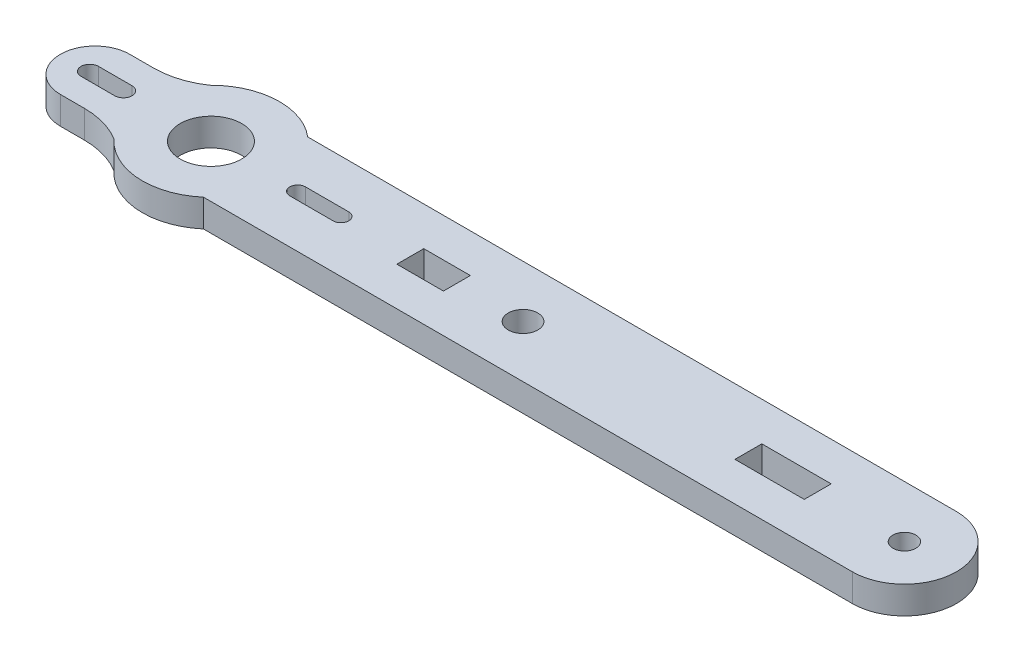
from build123d import *

# Parameters (mm, degrees)
SKETCH1_R           = 1.322622219
SKETCH1_R_2         = 1.7
SKETCH1_R_3         = 3.543581518
SKETCH1_W           = 5.363642664
SKETCH1_H           = 3.09972609
BOSS_EXTRUDE1_DEPTH = 3.175


with BuildPart() as part:
    # Sketch1 → Boss-Extrude1 (new body)
    with BuildSketch(Plane(origin=(0, 0, 0), x_dir=(1, 0, 0), z_dir=(0, 1, 0))):
        with BuildLine():
            Line((-30.420224954, 6.394505262), (44.302185909, 6.390032423))
            ThreePointArc((44.302185909, 6.390032423), (50.304735151, 0.387483181), (44.302185909, -5.61506606))
            Line((44.302185909, -5.61506606), (-30.420308604, -5.61506606))
            ThreePointArc((-30.420308604, -5.61506606), (-36.033562007, -7.500021548), (-41.380965097, -4.957001462))
            ThreePointArc((-41.380965097, -4.957001462), (-43.672708861, -3.953506377), (-46.150888165, -3.610404055))
            Line((-46.150888165, -3.610404055), (-48.909665253, -3.610404055))
            ThreePointArc((-48.909665253, -3.610404055), (-52.90984424, 0.389774933), (-48.909665253, 4.38995392))
            Line((-48.909665253, 4.38995392), (-46.150888165, 4.38995392))
            ThreePointArc((-46.150888165, 4.38995392), (-43.564402624, 4.780712621), (-41.208786399, 5.918109658))
            ThreePointArc((-41.208786399, 5.918109658), (-35.908549497, 8.286044856), (-30.420224954, 6.394505262))
        make_face()
        with Locations(Location((44.302185909, 0.387483181, 0), (0, 0, 270))):
            Circle(SKETCH1_R, mode=Mode.SUBTRACT)
        with Locations(Location((0.383109325, 0.385153592, 0), (0, 0, 270))):
            Circle(SKETCH1_R_2, mode=Mode.SUBTRACT)
        with Locations(Location((-35.559869313, 0.389755399, 0), (0, 0, 270))):
            Circle(SKETCH1_R_3, mode=Mode.SUBTRACT)
        Polygon((34.320012777, 1.885218269), (34.320012777, 1.935143597), (26.334122715, 1.935143597), (26.334122715, 1.885218269), (26.334122715, -1.114852491), (26.334122715, -1.164973144), (34.320012777, -1.164973144), (34.320012777, -1.114852491), align=None, mode=Mode.SUBTRACT)
        with Locations((-9.914943428, 0.385085228)):
            Rectangle(SKETCH1_W, SKETCH1_H, mode=Mode.SUBTRACT)
        with BuildLine():
            Line((-20.582664571, -0.514889121), (-25.573840985, -0.514889121))
            ThreePointArc((-25.573840985, -0.514889121), (-26.473815335, 0.385085229), (-25.573840985, 1.285059578))
            Line((-25.573840985, 1.285059578), (-20.582664571, 1.285059578))
            ThreePointArc((-20.582664571, 1.285059578), (-19.682690221, 0.385085229), (-20.582664571, -0.514889121))
        make_face(mode=Mode.SUBTRACT)
        with BuildLine():
            Line((-49.512218616, 1.385222757), (-45.638080248, 1.385222757))
            ThreePointArc((-45.638080248, 1.385222757), (-44.638040384, 0.385182893), (-45.638080248, -0.614856971))
            Line((-45.638080248, -0.614856971), (-49.512218616, -0.614856971))
            ThreePointArc((-49.512218616, -0.614856971), (-50.51225848, 0.385182893), (-49.512218616, 1.385222757))
        make_face(mode=Mode.SUBTRACT)
    extrude(amount=BOSS_EXTRUDE1_DEPTH)


solid = part.part
